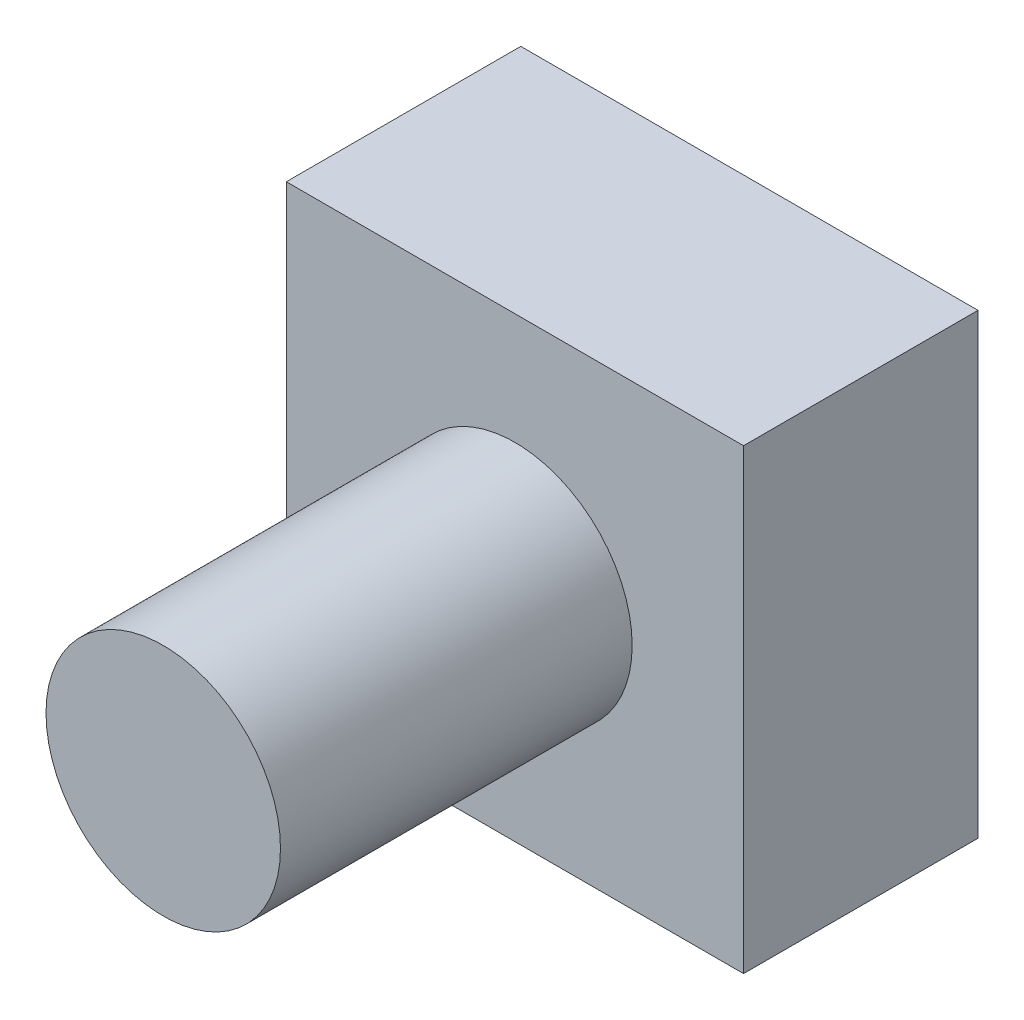
from build123d import *

# Parameters (mm, degrees)
BODY_SKETCH_W = 78
BODY_SKETCH_H = 78
BODY_DEPTH    = 40
BOSS_SKETCH_R = 20
BOSS_DEPTH    = 60


with BuildPart() as part:
    # Body sketch → Body (new body)
    with BuildSketch(Plane.XY):
        with Locations((39, 39)):
            Rectangle(BODY_SKETCH_W, BODY_SKETCH_H)
    extrude(amount=BODY_DEPTH)

    # Boss sketch → Boss (add)
    with BuildSketch(Plane.XY.offset(40)):
        with Locations((39, 39)):
            Circle(BOSS_SKETCH_R)
    extrude(amount=BOSS_DEPTH)


solid = part.part
